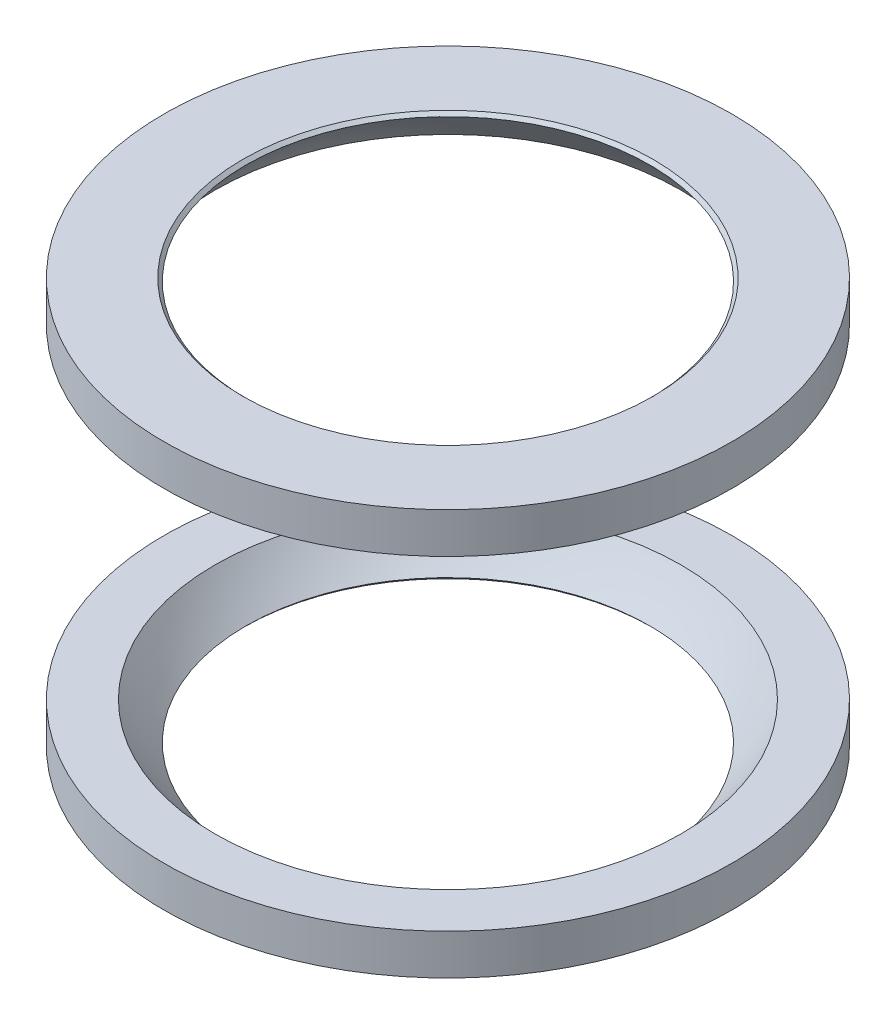
from build123d import *

# Parameters (mm, degrees)
SKETCH1_R           = 11.112499999999999
BOSS_EXTRUDE1_DEPTH = 19.05
SKETCH2_R           = 6.35
CUT_EXTRUDE1_DEPTH  = 25.69570433294017
SKETCH4_W           = 30.524379262921272
SKETCH4_H           = 12.7
CUT_EXTRUDE2_DEPTH  = 25.4
SKETCH5_W           = 22.224999999999998
SKETCH5_H           = 1.5874999999999986
CUT_EXTRUDE3_DEPTH  = 25.4
CHAMFER2_SIZE       = 0.254
CHAMFER2_SIZE2      = 0.17961447466301902
CHAMFER3_SIZE       = 0.254
CHAMFER3_SIZE2      = 0.17961447466301902


with BuildPart() as part:
    # Sketch1 → Boss-Extrude1 (new body)
    with BuildSketch(Plane(origin=(0, 0, 0), x_dir=(1, 0, 0), z_dir=(0, 1, 0))):
        with Locations(Location((0, 0, 0), (0, 0, 90))):
            Circle(SKETCH1_R)
    extrude(amount=BOSS_EXTRUDE1_DEPTH)

    # Sketch2 → Cut-Extrude1 (cut, through all)
    with BuildSketch(Plane(origin=(0, 19.05, 0), x_dir=(1, 0, 0), z_dir=(0, 1, 0))):
        with Locations(Location((0, 0, 0), (0, 0, 270))):
            Circle(SKETCH2_R)
    extrude(amount=-CUT_EXTRUDE1_DEPTH, mode=Mode.SUBTRACT)

    # Sketch3 → Cut-Revolve1 (revolve, cut)
    with BuildSketch(Plane.XY):
        with BuildLine():
            Line((-1.9e-16, 20.637500000000003), (2.53e-15, -1.5874999999999952))
            ThreePointArc((2.53e-15, -1.5874999999999952), (-11.112499999999999, 9.525000000000006), (-1.9e-16, 20.637500000000003))
        make_face()
    revolve(axis=Axis((-1.9e-16, 23.066651012529398, 0), (1e-17, -1, 0)), mode=Mode.SUBTRACT)


with BuildPart() as cut_revolve1_piece_1:
    # of the separate pieces the step leaves, piece 1, a body of its own (cut_revolve1_pieces)
    add(part.part.solids().sort_by_distance((0, 0, -11.1125))[0])


with BuildPart() as cut_revolve1_piece_2:
    # of the separate pieces the step leaves, piece 2, a body of its own (cut_revolve1_pieces)
    add(part.part.solids().sort_by_distance((0, 19.05, -11.1125))[0])


with BuildPart() as cut_extrude2_tool:
    # Sketch4 → Cut-Extrude2 (new, symmetric)
    with BuildSketch(Plane.XY):
        with Locations((-7.11e-15, 9.525000000000004)):
            Rectangle(SKETCH4_W, SKETCH4_H)
    extrude(amount=CUT_EXTRUDE2_DEPTH, both=True)


with BuildPart() as cut_revolve1_piece_1_1:
    add(cut_revolve1_piece_1.part)

    # Cut-Extrude2: cut by cut_extrude2_tool
    add(cut_extrude2_tool.part, mode=Mode.SUBTRACT)


with BuildPart() as cut_revolve1_piece_2_1:
    add(cut_revolve1_piece_2.part)

    # Cut-Extrude2: cut by cut_extrude2_tool
    add(cut_extrude2_tool.part, mode=Mode.SUBTRACT)


with BuildPart() as cut_extrude3_tool:
    # Sketch5 → Cut-Extrude3 (new, symmetric)
    with BuildSketch(Plane.XY):
        with Locations((0, 18.25625)):
            Rectangle(SKETCH5_W, SKETCH5_H)
        Polygon((-11.112499999999999, 1.388e-14), (11.112499999999999, 1.388e-14), (11.112499999999999, 1.5875000000000017), (-11.112499999999999, 1.5875000000000026), align=None)
    extrude(amount=CUT_EXTRUDE3_DEPTH, both=True)


with BuildPart() as cut_revolve1_piece_1_2:
    add(cut_revolve1_piece_1_1.part)

    # Cut-Extrude3: cut by cut_extrude3_tool
    add(cut_extrude3_tool.part, mode=Mode.SUBTRACT)

    # Chamfer3
    chamfer3_edges = [cut_revolve1_piece_1_2.edges().sort_by_distance(p)[0] for p in [
        (7.777129933336585, 1.5875000000000021, 9.5e-16),
    ]]
    chamfer3_side = [cut_revolve1_piece_1_2.faces().sort_by_distance(p)[0] for p in [
        (-1.53e-15, 1.5875000000000021, 10.798191035762574),
    ]]
    chamfer(chamfer3_edges, length=CHAMFER3_SIZE, length2=CHAMFER3_SIZE2, reference=chamfer3_side[0])


with BuildPart() as cut_revolve1_piece_2_2:
    add(cut_revolve1_piece_2_1.part)

    # Cut-Extrude3: cut by cut_extrude3_tool
    add(cut_extrude3_tool.part, mode=Mode.SUBTRACT)

    # Chamfer2
    chamfer2_edges = [cut_revolve1_piece_2_2.edges().sort_by_distance(p)[0] for p in [
        (7.777129933336592, 17.462500000000002, 9.5e-16),
    ]]
    chamfer2_side = [cut_revolve1_piece_2_2.faces().sort_by_distance(p)[0] for p in [
        (6.6e-16, 17.462500000000002, 10.798191035762578),
    ]]
    chamfer(chamfer2_edges, length=CHAMFER2_SIZE, length2=CHAMFER2_SIZE2, reference=chamfer2_side[0])


solid = Compound([cut_revolve1_piece_1_2.part, cut_revolve1_piece_2_2.part])
